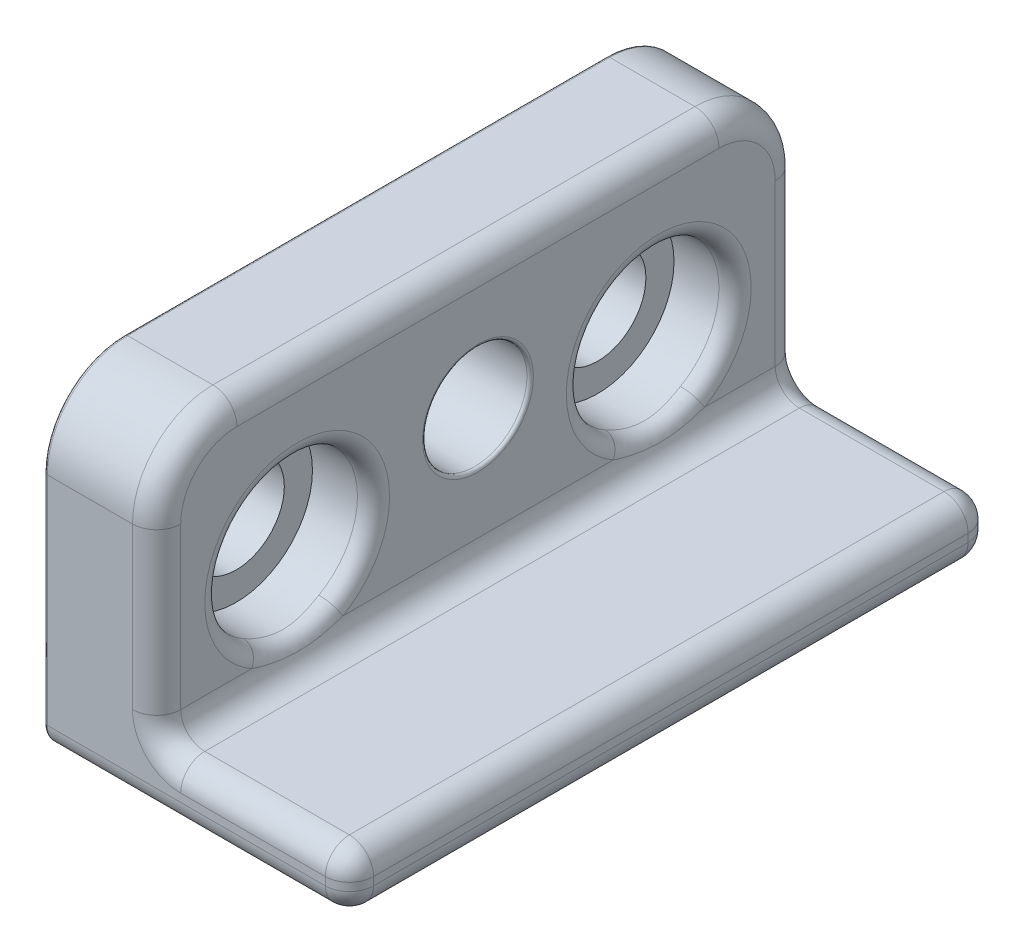
from build123d import *

# Parameters (mm, degrees)
SKETCH1_W           = 7
SKETCH1_H           = 40
BOSS_EXTRUDE1_DEPTH = 10
BOSS_EXTRUDE2_START = -10
SKETCH1_3_W         = 12
SKETCH1_3_H         = 40
BOSS_EXTRUDE2_DEPTH = 3.5
SKETCH2_R           = 3
SKETCH2_R_2         = 3.25
CUT_EXTRUDE1_DEPTH  = 7
CUT_EXTRUDE2_START  = -3.2
SKETCH2_3_R         = 4.75
SKETCH2_3_R_2       = 3
CUT_EXTRUDE2_DEPTH  = 3.8
FILLET5_R           = 5
FILLET6_R           = 1.5
FILLET7_R           = 1
FILLET8_R           = 0.2


with BuildPart() as part:
    # Sketch1 → Boss-Extrude1 (new, symmetric)
    with BuildSketch(Plane(origin=(0, 0, 0), x_dir=(1, 0, 0), z_dir=(0, 1, 0))):
        with Locations((-7.5, 0)):
            Rectangle(SKETCH1_W, SKETCH1_H)
    extrude(amount=BOSS_EXTRUDE1_DEPTH, both=True)

    # Sketch1<3> → Boss-Extrude2 (add)
    with BuildSketch(Plane(origin=(0, 0, 0), x_dir=(1, 0, 0), z_dir=(0, 1, 0)).offset(BOSS_EXTRUDE2_START)):
        with Locations((2, 0)):
            Rectangle(SKETCH1_3_W, SKETCH1_3_H)
    extrude(amount=BOSS_EXTRUDE2_DEPTH)

    # Sketch2 → Cut-Extrude1 (cut)
    with BuildSketch(Plane.ZY.offset(11)):
        with Locations((11.25, 0)):
            Circle(SKETCH2_R)
        with Locations((0, 2)):
            Circle(SKETCH2_R_2)
        with Locations((-11.25, 0)):
            Circle(SKETCH2_R)
    extrude(amount=-CUT_EXTRUDE1_DEPTH, mode=Mode.SUBTRACT)

    # Sketch2<3> → Cut-Extrude2 (cut)
    # profile 1 of 2: a face of its own
    with BuildSketch(Plane.ZY.offset(11).offset(CUT_EXTRUDE2_START)):
        with Locations(Location((-11.25, 0, 0), (0, 0, 180))):
            Circle(SKETCH2_3_R)
        with Locations((-11.25, 0)):
            Circle(SKETCH2_3_R_2, mode=Mode.SUBTRACT)
    # profile 2 of 2: a face of its own
    with BuildSketch(Plane.ZY.offset(11).offset(CUT_EXTRUDE2_START)):
        with Locations(Location((11.25, 0, 0), (0, 0, 180))):
            Circle(SKETCH2_3_R)
        with Locations((11.25, 0)):
            Circle(SKETCH2_3_R_2, mode=Mode.SUBTRACT)
    extrude(amount=-CUT_EXTRUDE2_DEPTH, mode=Mode.SUBTRACT)

    # Fillet5
    fillet5_edges = [part.edges().sort_by_distance(p)[0] for p in [
        (-7.5, 10, -20),
        (-7.5, 10, 20),
    ]]
    fillet(fillet5_edges, radius=FILLET5_R)

    # Fillet6
    fillet6_edges = [part.edges().sort_by_distance(p)[0] for p in [
        (8, -10, 0),
        (8, -8.25, 20),
        (8, -8.25, -20),
        (8, -6.5, 0),
        (2, -6.5, -20),
        (-4, -6.5, 0),
        (2, -6.5, 20),
        (-4, 10, 0),
        (-1.5, -10, 20),
        (-4, -0.75, -20),
        (-4, -0.75, 20),
        (-4, 8.535533906, -18.535533906),
        (-4, 8.535533906, 18.535533906),
        (-1.5, -10, -20),
    ]]
    fillet(fillet6_edges, radius=FILLET6_R)

    # Fillet7
    fillet7_edges = [part.edges().sort_by_distance(p)[0] for p in [
        (-4, 0, -6.5),
        (-4, 0, 16),
    ]]
    fillet(fillet7_edges, radius=FILLET7_R)

    # Fillet8
    fillet8_edges = [part.edges().sort_by_distance(p)[0] for p in [
        (-11, 0, 8.25),
        (-11, 2, -3.25),
        (-4, 2, -3.25),
        (-11, 0, -14.25),
        (-11, 10, 0),
        (-11, -1.75, 20),
        (-11, -1.75, -20),
        (-11, 8.535533906, -18.535533906),
        (-11, 8.535533906, 18.535533906),
        (-11, -10, 0),
        (-11, -9.560660172, -19.560660172),
        (-11, -9.560660172, 19.560660172),
    ]]
    fillet(fillet8_edges, radius=FILLET8_R)


solid = part.part
